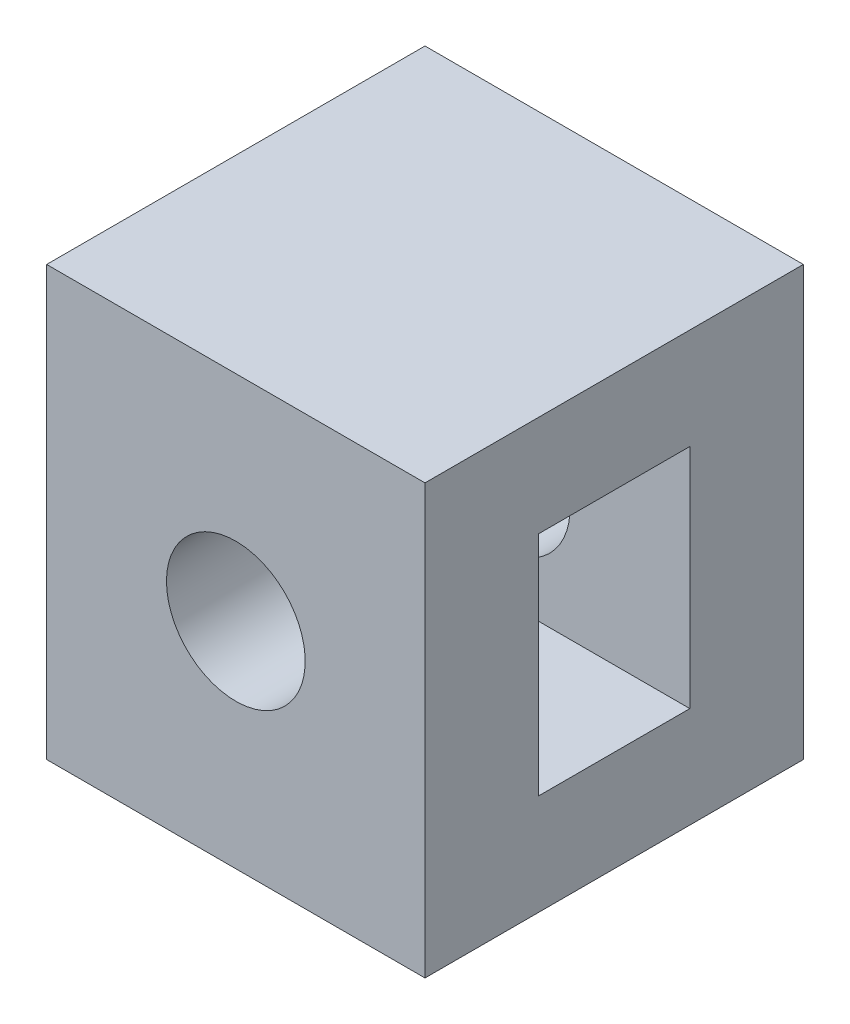
from build123d import *

# Parameters (mm, degrees)
SKETCH1_W           = 15
SKETCH1_H           = 15
BOSS_EXTRUDE1_DEPTH = 17
SKETCH2_W           = 6
SKETCH2_H           = 9
CUT_EXTRUDE1_DEPTH  = 12
SKETCH5_R           = 2.75
CUT_EXTRUDE2_DEPTH  = 28.184554438


with BuildPart() as part:
    # Sketch1 → Boss-Extrude1 (new body)
    with BuildSketch(Plane(origin=(0, 0, 0), x_dir=(1, 0, 0), z_dir=(0, 1, 0))):
        with Locations((7.5, -7.5)):
            Rectangle(SKETCH1_W, SKETCH1_H)
    extrude(amount=BOSS_EXTRUDE1_DEPTH)

    # Sketch2 → Cut-Extrude1 (cut)
    with BuildSketch(Plane(origin=(15, 0, 0), x_dir=(0, 0, -1), z_dir=(1, 0, 0))):
        with Locations((-7.5, 8.5)):
            Rectangle(SKETCH2_W, SKETCH2_H)
    extrude(amount=-CUT_EXTRUDE1_DEPTH, mode=Mode.SUBTRACT)

    # Sketch5 → Cut-Extrude2 (cut, through all)
    with BuildSketch(Plane(origin=(0, 0, 0), x_dir=(-1, 0, 0), z_dir=(0, 0, -1))):
        with Locations((-7.5, 8.5)):
            Circle(SKETCH5_R)
    extrude(amount=-CUT_EXTRUDE2_DEPTH, mode=Mode.SUBTRACT)


solid = part.part
